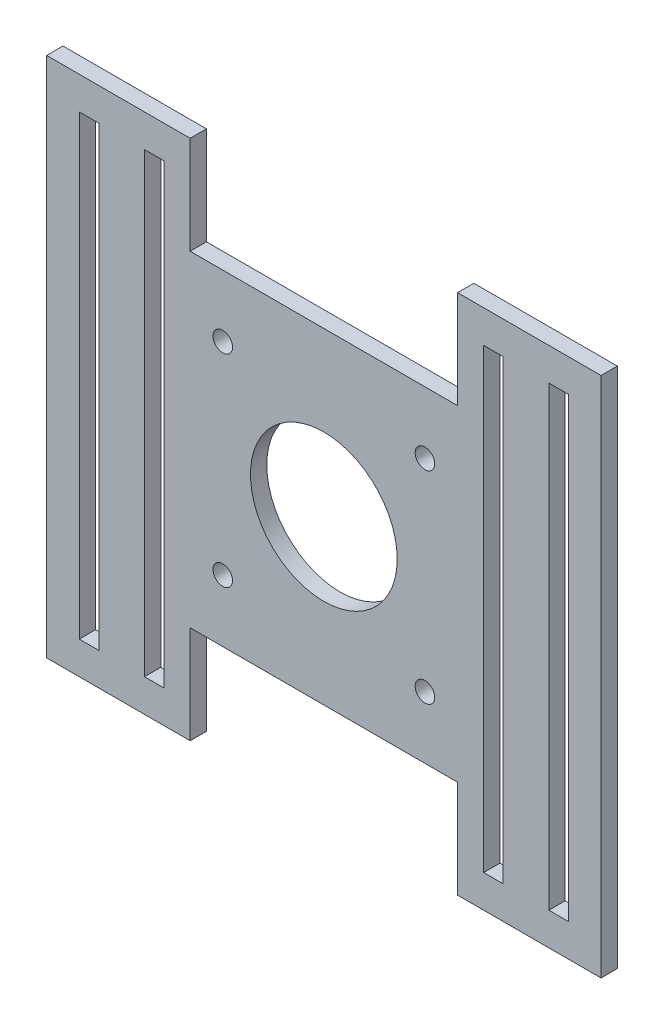
from build123d import *

# Parameters (mm, degrees)
SKETCH1_W                 = 85
SKETCH1_H                 = 50
BOSS_EXTRUDE1_DEPTH       = 2.5
SKETCH5_W                 = 22
SKETCH5_H                 = 15
BOSS_EXTRUDE2_DEPTH       = 2.5
LPATTERN4_COUNT           = 2
LPATTERN4_PITCH           = 63
LPATTERN5_COUNT           = 2
LPATTERN5_PITCH           = 65
LPATTERN5_COPY_1_SKETCH_W = 22
LPATTERN5_COPY_1_SKETCH_H = 15
LPATTERN5_COPY_1_DEPTH    = 2.5
SKETCH2_W                 = 3
SKETCH2_H                 = 70
CUT_EXTRUDE1_DEPTH        = 2.5
LPATTERN1_COUNT           = 2
LPATTERN1_PITCH           = 62
SKETCH3_R                 = 11.25
CUT_EXTRUDE2_DEPTH        = 108.033873143
SKETCH4_R                 = 1.5
CUT_EXTRUDE3_DEPTH        = 108.033873143
LPATTERN2_COUNT           = 2
LPATTERN2_PITCH           = 31
LPATTERN3_COUNT           = 2
LPATTERN3_PITCH           = 31
LPATTERN3_COPY_1_SKETCH_R = 1.5
LPATTERN3_COPY_1_DEPTH    = 108.033873143


with BuildPart() as part:
    # Sketch1 → Boss-Extrude1 (new body)
    with BuildSketch(Plane.XY):
        with Locations((42.5, 25)):
            Rectangle(SKETCH1_W, SKETCH1_H)
    extrude(amount=BOSS_EXTRUDE1_DEPTH)

    # Sketch5 → Boss-Extrude2 (add)
    with BuildSketch(Plane.XY):
        with Locations((11, 57.5)):
            Rectangle(SKETCH5_W, SKETCH5_H)
    boss_extrude2 = extrude(amount=BOSS_EXTRUDE2_DEPTH)

    # LPattern4: Boss-Extrude2 ×2
    with Locations(*[(i * LPATTERN4_PITCH, 0, 0) for i in range(1, LPATTERN4_COUNT)]):
        add(boss_extrude2)

    # LPattern5: Boss-Extrude2 ×2
    with Locations(*[(0, -i * LPATTERN5_PITCH, 0) for i in range(1, LPATTERN5_COUNT)]):
        add(boss_extrude2)

    # LPattern5 copy 1 sketch → LPattern5 copy 1 (add)
    with BuildSketch(Plane(origin=(63, -65, 0), x_dir=(1, 0, 0), z_dir=(0, 0, 1))):
        with Locations((11, 57.5)):
            Rectangle(LPATTERN5_COPY_1_SKETCH_W, LPATTERN5_COPY_1_SKETCH_H)
    extrude(amount=LPATTERN5_COPY_1_DEPTH)

    # Sketch2 → Cut-Extrude1 (cut)
    with BuildSketch(Plane.XY.offset(2.5)):
        with Locations((6.5, 25)):
            Rectangle(SKETCH2_W, SKETCH2_H)
        with Locations((16.5, 25)):
            Rectangle(SKETCH2_W, SKETCH2_H)
    cut_extrude1 = extrude(amount=-CUT_EXTRUDE1_DEPTH, mode=Mode.SUBTRACT)

    # LPattern1: Cut-Extrude1 ×2
    with Locations(*[(i * LPATTERN1_PITCH, 0, 0) for i in range(1, LPATTERN1_COUNT)]):
        add(cut_extrude1, mode=Mode.SUBTRACT)

    # Sketch3 → Cut-Extrude2 (cut, through all)
    with BuildSketch(Plane.XY.offset(2.5)):
        with Locations((42.5, 25)):
            Circle(SKETCH3_R)
    extrude(amount=-CUT_EXTRUDE2_DEPTH, mode=Mode.SUBTRACT)

    # Sketch4 → Cut-Extrude3 (cut, through all)
    with BuildSketch(Plane.XY.offset(2.5)):
        with Locations((27, 40.5)):
            Circle(SKETCH4_R)
    cut_extrude3 = extrude(amount=-CUT_EXTRUDE3_DEPTH, mode=Mode.SUBTRACT)

    # LPattern2: Cut-Extrude3 ×2
    with Locations(*[(0, -i * LPATTERN2_PITCH, 0) for i in range(1, LPATTERN2_COUNT)]):
        add(cut_extrude3, mode=Mode.SUBTRACT)

    # LPattern3: Cut-Extrude3 ×2
    with Locations(*[(i * LPATTERN3_PITCH, 0, 0) for i in range(1, LPATTERN3_COUNT)]):
        add(cut_extrude3, mode=Mode.SUBTRACT)

    # LPattern3 copy 1 sketch → LPattern3 copy 1 (cut, through all)
    with BuildSketch(Plane(origin=(31, -31, 2.5), x_dir=(1, 0, 0), z_dir=(0, 0, 1))):
        with Locations((27, 40.5)):
            Circle(LPATTERN3_COPY_1_SKETCH_R)
    extrude(amount=-LPATTERN3_COPY_1_DEPTH, mode=Mode.SUBTRACT)


solid = part.part
